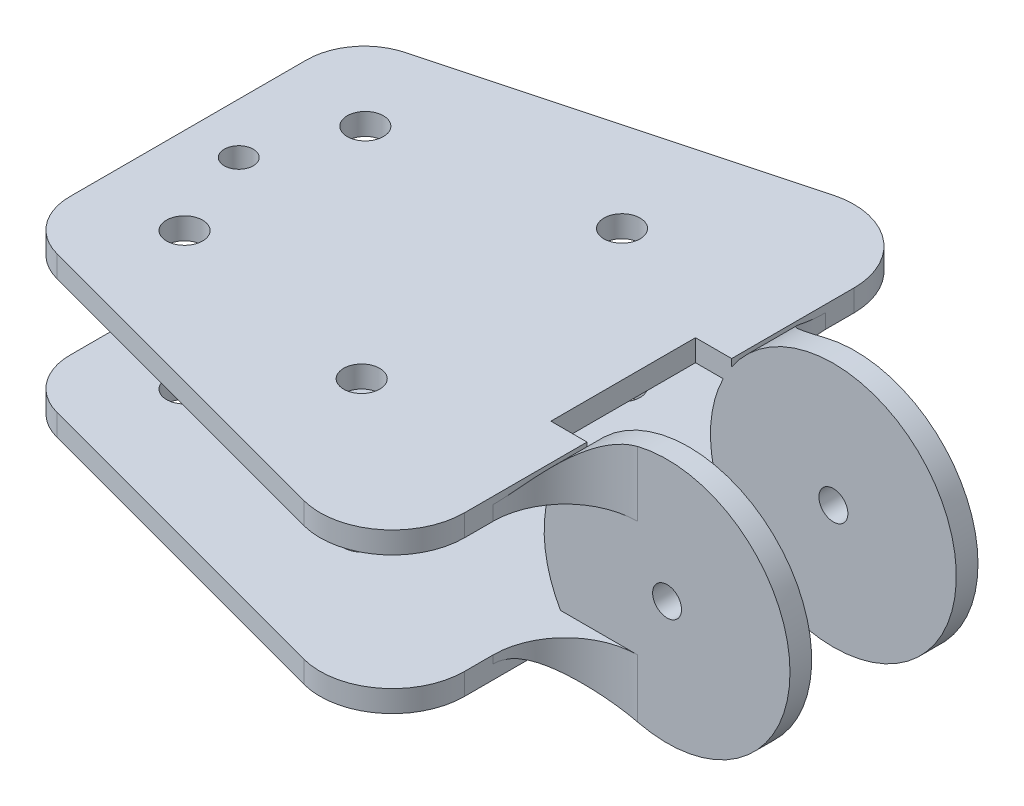
from build123d import *

# Parameters (mm, degrees)
CROQUIS1_R                = 2.5
CROQUIS1_R_2              = 2
SALIENTE_EXTRUIR1_DEPTH   = 22
CROQUIS2_W                = 80
CROQUIS2_H                = 16
CORTAR_EXTRUIR1_DEPTH     = 50
SALIENTE_EXTRUIR2_DEPTH   = 16
SALIENTE_EXTRUIR2_2_DEPTH = 16
SALIENTE_EXTRUIR2_3_DEPTH = 16
SKETCH2_W                 = 24.073282634
SKETCH2_H                 = 99.797965629
CUT_EXTRUDE3_DEPTH        = 31
FILLET2_R                 = 10
FILLET3_R                 = 10
BOSS_EXTRUDE1_DEPTH       = 13
BOSS_EXTRUDE1_DEPTH_BACK  = 13
SKETCH3_R                 = 17
CUT_EXTRUDE4_DEPTH        = 51
CUT_EXTRUDE4_DEPTH_BACK   = 51
SKETCH4_W                 = 61.979408986
SKETCH4_H                 = 20
SKETCH5_R                 = 2
CUT_EXTRUDE5_DEPTH        = 51
FILLET4_R                 = 10


with BuildPart() as part:
    # Croquis1 → Saliente-Extruir1 (new body)
    with BuildSketch(Plane(origin=(0, 0, 0), x_dir=(1, 0, 0), z_dir=(0, 1, 0))):
        with BuildLine():
            Line((0, 16.361384096), (0, -16.361384096))
            ThreePointArc((0, -16.361384096), (1.653173278, -21.231475528), (5.929447639, -24.088790706))
            Line((5.929447639, -24.088790706), (69.929447639, -41.237539022))
            ThreePointArc((69.929447639, -41.237539022), (76.870091432, -39.856959134), (80, -33.510132412))
            Line((80, -33.510132412), (80, 33.510132412))
            ThreePointArc((80, 33.510132412), (76.870091432, 39.856959134), (69.929447639, 41.237539022))
            Line((69.929447639, 41.237539022), (5.929447639, 24.088790706))
            ThreePointArc((5.929447639, 24.088790706), (1.653173278, 21.231475528), (0, 16.361384096))
        make_face()
        with Locations((12, 12.5)):
            Circle(CROQUIS1_R, mode=Mode.SUBTRACT)
        with Locations((12, -12.5)):
            Circle(CROQUIS1_R, mode=Mode.SUBTRACT)
        with Locations((42, 18)):
            Circle(CROQUIS1_R, mode=Mode.SUBTRACT)
        with Locations((42, -18)):
            Circle(CROQUIS1_R, mode=Mode.SUBTRACT)
        with Locations((7, 0)):
            Circle(CROQUIS1_R_2, mode=Mode.SUBTRACT)
        with Locations((72, -30)):
            Circle(CROQUIS1_R_2, mode=Mode.SUBTRACT)
        with Locations((72, 30)):
            Circle(CROQUIS1_R_2, mode=Mode.SUBTRACT)
    extrude(amount=SALIENTE_EXTRUIR1_DEPTH)

    # Croquis2 → Cortar-Extruir1 (cut, symmetric)
    with BuildSketch(Plane.XY):
        with Locations((40, 11)):
            Rectangle(CROQUIS2_W, CROQUIS2_H)
    extrude(amount=CORTAR_EXTRUIR1_DEPTH, both=True, mode=Mode.SUBTRACT)


with BuildPart() as cortar_extruir1_piece_1:
    # of the separate pieces the step leaves, piece 1, a body of its own (cortar_extruir1_pieces)
    add(part.part.solids().sort_by_distance((69.929447639, 0, -41.237539022))[0])


with BuildPart() as cortar_extruir1_piece_2:
    # of the separate pieces the step leaves, piece 2, a body of its own (cortar_extruir1_pieces)
    add(part.part.solids().sort_by_distance((5.929447639, 19, -24.088790706))[0])


with BuildPart() as body_3:
    # Croquis3 → Saliente-Extruir2 (new body)
    with BuildSketch(Plane(origin=(0, 3, 0), x_dir=(1, 0, 0), z_dir=(0, 1, 0))):
        Polygon((7, -2.309401077), (9, -1.154700538), (9, 1.154700538), (7, 2.309401077), (5, 1.154700538), (5, -1.154700538), align=None)
    extrude(amount=SALIENTE_EXTRUIR2_DEPTH)


with BuildPart() as body_4:
    # Croquis3 → Saliente-Extruir2 2 (new body)
    with BuildSketch(Plane(origin=(0, 3, 0), x_dir=(1, 0, 0), z_dir=(0, 1, 0))):
        Polygon((70.845299462, -32), (73.154700538, -32), (74.309401077, -30), (73.154700538, -28), (70.845299462, -28), (69.690598923, -30), align=None)
    extrude(amount=SALIENTE_EXTRUIR2_2_DEPTH)


with BuildPart() as body_5:
    # Croquis3 → Saliente-Extruir2 3 (new body)
    with BuildSketch(Plane(origin=(0, 3, 0), x_dir=(1, 0, 0), z_dir=(0, 1, 0))):
        Polygon((74, 28.845299462), (74, 31.154700538), (72, 32.309401077), (70, 31.154700538), (70, 28.845299462), (72, 27.690598923), align=None)
    extrude(amount=SALIENTE_EXTRUIR2_3_DEPTH)


with BuildPart() as cut_extrude3_tool:
    # Sketch2 → Cut-Extrude3 (new body)
    with BuildSketch(Plane(origin=(0, 0, 0), x_dir=(1, 0, 0), z_dir=(0, 1, 0))):
        with Locations((77.197652104, 1.837365647)):
            Rectangle(SKETCH2_W, SKETCH2_H)
    extrude(amount=CUT_EXTRUDE3_DEPTH)


with BuildPart() as cortar_extruir1_piece_1_1:
    add(cortar_extruir1_piece_1.part)

    # Cut-Extrude3: cut by cut_extrude3_tool
    add(cut_extrude3_tool.part, mode=Mode.SUBTRACT)

    # Fillet3
    fillet3_edges = [cortar_extruir1_piece_1_1.edges().sort_by_distance(p)[0] for p in [
        (65.161010787, 1.5, 39.959840218),
        (65.161010787, 1.5, -39.959840218),
    ]]
    fillet(fillet3_edges, radius=FILLET3_R)



with BuildPart() as cortar_extruir1_piece_2_1:
    add(cortar_extruir1_piece_2.part)

    # Cut-Extrude3: cut by cut_extrude3_tool
    add(cut_extrude3_tool.part, mode=Mode.SUBTRACT)

    # Fillet2
    fillet2_edges = [cortar_extruir1_piece_2_1.edges().sort_by_distance(p)[0] for p in [
        (65.161010787, 20.5, -39.959840218),
        (65.161010787, 20.5, 39.959840218),
    ]]
    fillet(fillet2_edges, radius=FILLET2_R)


with BuildPart() as body_4_1:
    add(body_4.part)

    # Cut-Extrude3: cut by cut_extrude3_tool
    add(cut_extrude3_tool.part, mode=Mode.SUBTRACT)


with BuildPart() as body_5_1:
    add(body_5.part)

    # Cut-Extrude3: cut by cut_extrude3_tool
    add(cut_extrude3_tool.part, mode=Mode.SUBTRACT)


with BuildPart() as cortar_extruir1_piece_1_2:
    add(cortar_extruir1_piece_1_1.part)

    add(cortar_extruir1_piece_2_1.part)  # Boss-Extrude1 merges Cortar-Extruir1 piece 2
    # Sketch3 → Boss-Extrude1 (add, two sides: drawn at the far end of the back side and taken through both)
    with BuildSketch(Plane.XY.offset(-BOSS_EXTRUDE1_DEPTH_BACK)):
        with Locations((79.23136181, 11.465223166)):
            Circle(SKETCH3_R)
    extrude(amount=BOSS_EXTRUDE1_DEPTH + BOSS_EXTRUDE1_DEPTH_BACK)

    # Sketch4 → Cut-Extrude4 (cut, two sides: drawn at the far end of the back side and taken through both)
    with BuildSketch(Plane(origin=(0, 0, 0), x_dir=(1, 0, 0), z_dir=(0, 1, 0)).offset(-CUT_EXTRUDE4_DEPTH_BACK)):
        with Locations((91.15071528, 0)):
            Rectangle(SKETCH4_W, SKETCH4_H)
    extrude(amount=CUT_EXTRUDE4_DEPTH + CUT_EXTRUDE4_DEPTH_BACK, mode=Mode.SUBTRACT)

    # Sketch5 → Cut-Extrude5 (cut)
    with BuildSketch(Plane.XY.offset(13)):
        with Locations((79.23136181, 11.465223166)):
            Circle(SKETCH5_R)
    extrude(amount=-CUT_EXTRUDE5_DEPTH, mode=Mode.SUBTRACT)

    # Fillet4
    fillet4_edges = [cortar_extruir1_piece_1_2.edges().sort_by_distance(p)[0] for p in [
        (65.161010787, 20.002968543, 13),
        (65.161010787, 2.462254623, 13),
        (65.161010787, 20.002968543, -13),
        (65.161010787, 2.462254623, -13),
    ]]
    fillet(fillet4_edges, radius=FILLET4_R)


solid = Compound([body_3.part, cortar_extruir1_piece_1_2.part])
